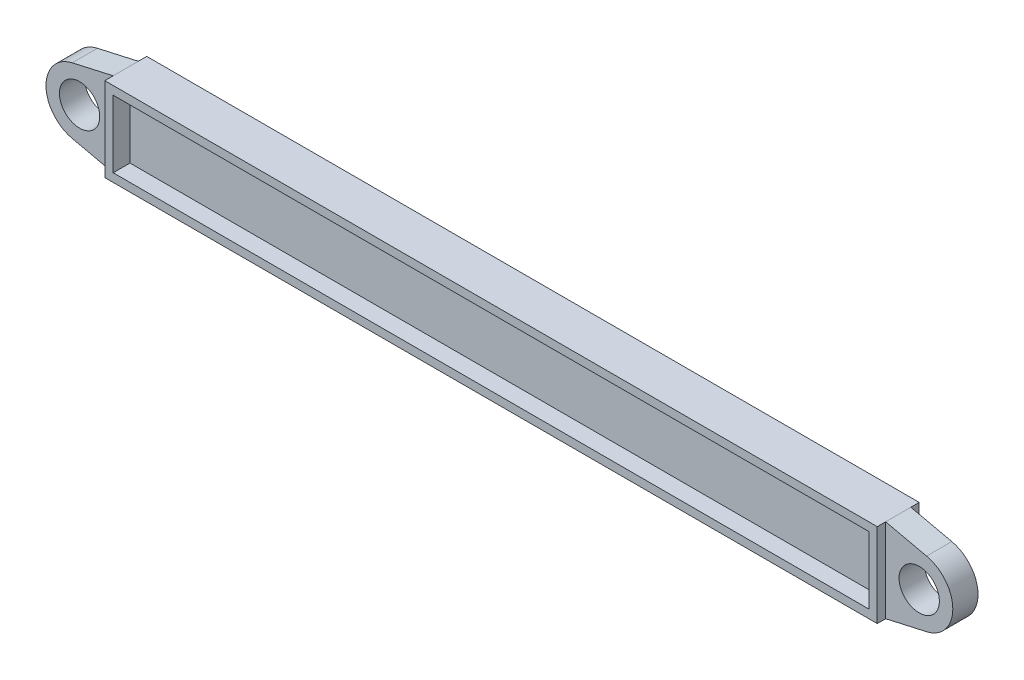
from build123d import *

# Parameters (mm, degrees)
SKETCH_1_R          = 12
EXTRUDE_1_DEPTH     = 25
CUT_EXTRUDE_START   = -5
CUT_EXTRUDE_1_DEPTH = 5
SKETCH_4_W          = 52.563829399
SKETCH_4_H          = 76.236989851
SKETCH_4_W_2        = 57.767152805
SKETCH_4_H_2        = 93.721065463
CUT_EXTRUDE_5_DEPTH = 5
SKETCH_5_W          = 450
SKETCH_5_H          = 40
CUT_EXTRUDE_6_DEPTH = 10
SKETCH_7_W          = 450
SKETCH_7_H          = 40
CUT_EXTRUDE_7_DEPTH = 10


with BuildPart() as part:
    # 草图1 → 凸台-拉伸1 (new body)
    with BuildSketch(Plane.XY):
        with BuildLine():
            Line((20.000001136, 44.999994952), (-4.390239864, 39.512196031))
            ThreePointArc((-4.390239864, 39.512196031), (-20, 20), (-4.390239864, 0.487803969))
            Line((-4.390239864, 0.487803969), (20.000001136, -4.999994952))
            Line((20.000001136, -4.999994952), (479.999998864, -4.999994952))
            Line((479.999998864, -4.999994952), (504.390239864, 0.487803969))
            ThreePointArc((504.390239864, 0.487803969), (520, 20), (504.390239864, 39.512196031))
            Line((504.390239864, 39.512196031), (479.999998864, 44.999994952))
            Line((479.999998864, 44.999994952), (20.000001136, 44.999994952))
        make_face()
        with Locations((0, 20)):
            Circle(SKETCH_1_R, mode=Mode.SUBTRACT)
        with Locations(Location((500, 20, 0), (0, 0, 180))):
            Circle(SKETCH_1_R, mode=Mode.SUBTRACT)
    extrude(amount=EXTRUDE_1_DEPTH)

    # 草图2 → 切除-拉伸1 (cut)
    with BuildSketch(Plane.XY.offset(25).offset(CUT_EXTRUDE_START)):
        with BuildLine():
            Line((-4.390239864, 39.512196031), (20.000001136, 44.999994952))
            Line((20.000001136, 44.999994952), (20.000001136, -4.999994952))
            Line((20.000001136, -4.999994952), (-4.390239864, 0.487803969))
            ThreePointArc((-4.390239864, 0.487803969), (-20, 20), (-4.390239864, 39.512196031))
        make_face()
        with BuildLine():
            Line((504.390239864, 39.512196031), (479.999998864, 44.999994952))
            Line((479.999998864, 44.999994952), (479.999998864, -4.999994952))
            Line((479.999998864, -4.999994952), (504.390239864, 0.487803969))
            ThreePointArc((504.390239864, 0.487803969), (520, 20), (504.390239864, 39.512196031))
        make_face()
    extrude(amount=CUT_EXTRUDE_1_DEPTH, mode=Mode.SUBTRACT)

    # 草图4 → 切除-拉伸5 (cut)
    with BuildSketch(Plane(origin=(0, 0, 0), x_dir=(-1, 0, 0), z_dir=(0, 0, -1))):
        with Locations((-506.281913563, 33.118499974)):
            Rectangle(SKETCH_4_W, SKETCH_4_H)
        with Locations((8.883575266, 41.86053778)):
            Rectangle(SKETCH_4_W_2, SKETCH_4_H_2)
    extrude(amount=-CUT_EXTRUDE_5_DEPTH, mode=Mode.SUBTRACT)

    # 草图5 → 切除-拉伸6 (cut)
    with BuildSketch(Plane(origin=(0, 0, 0), x_dir=(-1, 0, 0), z_dir=(0, 0, -1))):
        with Locations((-250.000001136, 19.999994952)):
            Rectangle(SKETCH_5_W, SKETCH_5_H)
    extrude(amount=-CUT_EXTRUDE_6_DEPTH, mode=Mode.SUBTRACT)

    # 草图7 → 切除-拉伸7 (cut)
    with BuildSketch(Plane.XY.offset(25)):
        with Locations((250.000001136, 20.000005048)):
            Rectangle(SKETCH_7_W, SKETCH_7_H)
    extrude(amount=-CUT_EXTRUDE_7_DEPTH, mode=Mode.SUBTRACT)


solid = part.part
